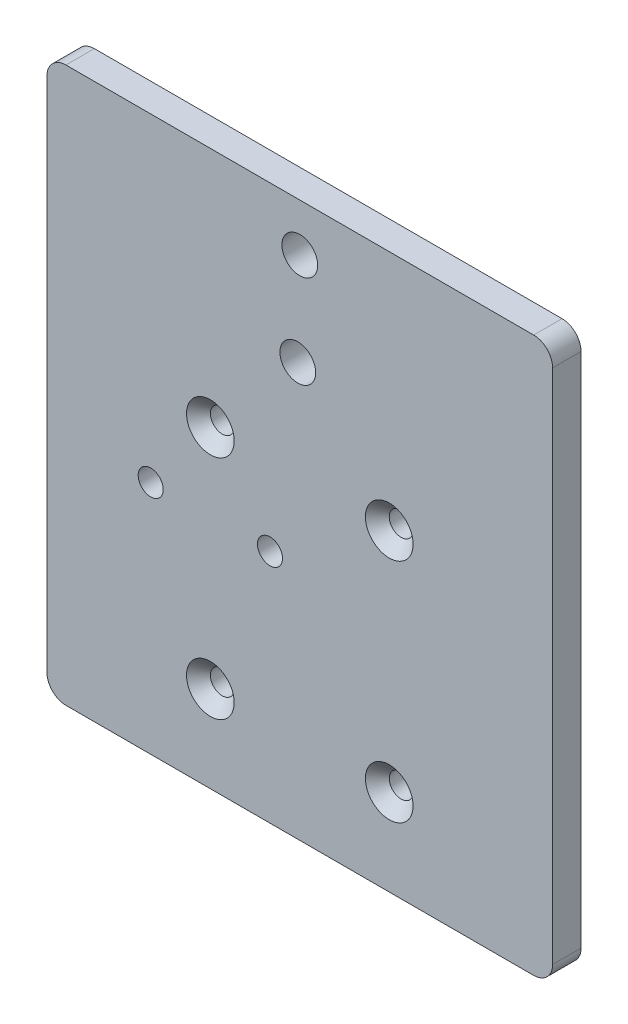
from build123d import *

# Parameters (mm, degrees)
SKETCH1_W                    = 84.8
SKETCH1_H                    = 93
SKETCH1_R                    = 2
BOSS_EXTRUDE1_DEPTH          = 4.7625
FILLET1_R                    = 3.18
F_6_0_6_DIAMETER_HOLE1_D     = 6
F_6_0_6_DIAMETER_HOLE1_DEPTH = 24
F_6_0_6_DIAMETER_HOLE1_TIP   = 1.802581857
CHAMFER1_SIZE                = 2
M5X0_8_TAPPED_HOLE1_D        = 4.2
M5X0_8_TAPPED_HOLE1_DEPTH    = 14
M5X0_8_TAPPED_HOLE1_TIP      = 1.2618073


with BuildPart() as part:
    # Sketch1 → Boss-Extrude1 (new body)
    with BuildSketch(Plane.XY):
        with Locations((0, 13)):
            Rectangle(SKETCH1_W, SKETCH1_H)
        with Locations(Location((15, -19, 0), (0, 0, 180))):
            Circle(SKETCH1_R, mode=Mode.SUBTRACT)
        with Locations(Location((-15, -19, 0), (0, 0, 180))):
            Circle(SKETCH1_R, mode=Mode.SUBTRACT)
        with Locations(Location((15, 19, 0), (0, 0, 180))):
            Circle(SKETCH1_R, mode=Mode.SUBTRACT)
        with Locations(Location((-15, 19, 0), (0, 0, 180))):
            Circle(SKETCH1_R, mode=Mode.SUBTRACT)
    extrude(amount=BOSS_EXTRUDE1_DEPTH)

    # Fillet1
    fillet1_edges = [part.edges().sort_by_distance(p)[0] for p in [
        (-42.4, -33.5, 2.38125),
        (-42.4, 59.5, 2.38125),
        (42.4, 59.5, 2.38125),
        (42.4, -33.5, 2.38125),
    ]]
    fillet(fillet1_edges, radius=FILLET1_R)

    # Ø6.0 (6) Diameter Hole1
    with Locations(Plane(origin=(0, 0, 0), x_dir=(-1, 0, 0), z_dir=(0, 0, -1))):
        with Locations((0, 51.5), (0.336501066, 35.75)):
            Hole(F_6_0_6_DIAMETER_HOLE1_D / 2, depth=F_6_0_6_DIAMETER_HOLE1_DEPTH)
            with Locations((0, 0, -(F_6_0_6_DIAMETER_HOLE1_DEPTH + F_6_0_6_DIAMETER_HOLE1_TIP / 2))):  # 118° drill point
                Cone(0, F_6_0_6_DIAMETER_HOLE1_D / 2, F_6_0_6_DIAMETER_HOLE1_TIP, mode=Mode.SUBTRACT)

    # Chamfer1
    chamfer1_edges = [part.edges().sort_by_distance(p)[0] for p in [
        (-13, -19, 4.7625),
        (17, 19, 4.7625),
        (-13, 19, 4.7625),
        (17, -19, 4.7625),
    ]]
    chamfer(chamfer1_edges, length=CHAMFER1_SIZE)

    # M5x0.8 Tapped Hole1
    with Locations(Plane.XY.offset(4.7625)):
        with Locations((-70.208358725, 8.341624021), (-69.847000611, 8.341624021), (-25, 5.982129573), (-5, 5.982129573)):
            Hole(M5X0_8_TAPPED_HOLE1_D / 2, depth=M5X0_8_TAPPED_HOLE1_DEPTH)
            with Locations((0, 0, -(M5X0_8_TAPPED_HOLE1_DEPTH + M5X0_8_TAPPED_HOLE1_TIP / 2))):  # 118° drill point
                Cone(0, M5X0_8_TAPPED_HOLE1_D / 2, M5X0_8_TAPPED_HOLE1_TIP, mode=Mode.SUBTRACT)


solid = part.part
